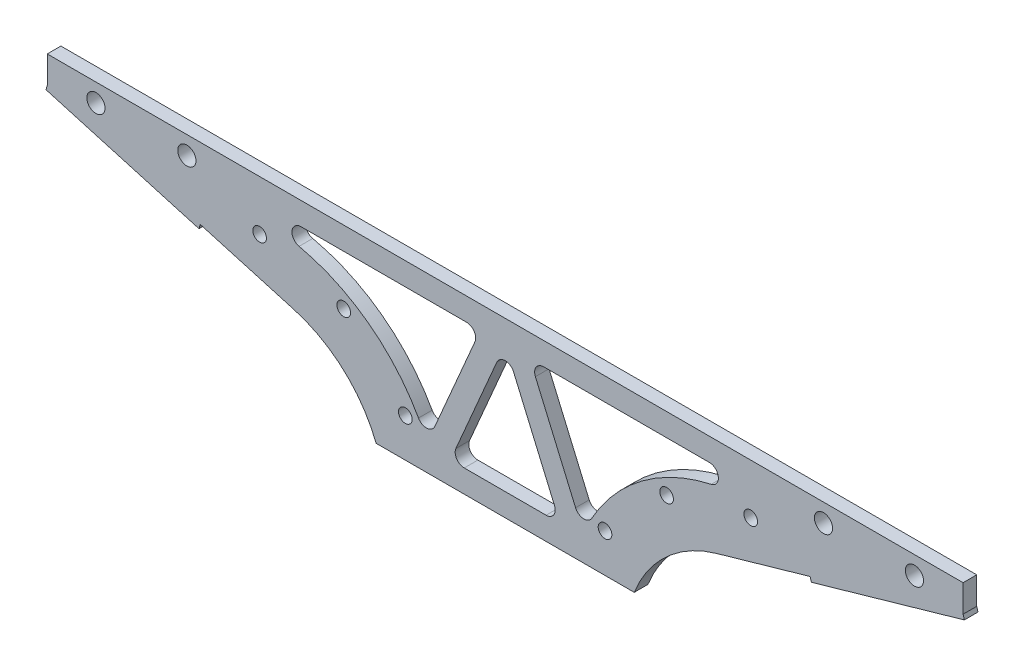
from build123d import *

# Parameters (mm, degrees)
SKETCH_1_R          = 1.5
SKETCH_1_R_2        = 2
EXTRUDE_1_DEPTH     = 3
EXTRUDE_2_DEPTH     = 3
CUT_EXTRUDE_1_DEPTH = 112.846375834


with BuildPart() as part:
    # 草图1 → 凸台-拉伸1 (new body)
    with BuildSketch(Plane.XY):
        with BuildLine():
            Line((-46.419972715, 26.434696638), (-100.702636481, 42))
            Line((-100.702636481, 42), (-100.702636481, 48))
            Line((-100.702636481, 48), (100.702636481, 48))
            Line((100.702636481, 48), (100.702636481, 42))
            Line((100.702636481, 42), (46.419972715, 26.434696638))
            ThreePointArc((46.419972715, 26.434696638), (35.478614393, 20.327525063), (28.382623085, 10))
            Line((28.382623085, 10), (-28.382623085, 10))
            ThreePointArc((-28.382623085, 10), (-35.478614393, 20.327525063), (-46.419972715, 26.434696638))
        make_face()
        with Locations((-54, 37)):
            Circle(SKETCH_1_R, mode=Mode.SUBTRACT)
        with Locations((-35.5, 32.04293994)):
            Circle(SKETCH_1_R, mode=Mode.SUBTRACT)
        with Locations((-21.95706006, 18.5)):
            Circle(SKETCH_1_R, mode=Mode.SUBTRACT)
        with Locations(Location((21.95706006, 18.5, 0), (0, 0, 180))):
            Circle(SKETCH_1_R, mode=Mode.SUBTRACT)
        with Locations(Location((35.5, 32.04293994, 0), (0, 0, 180))):
            Circle(SKETCH_1_R, mode=Mode.SUBTRACT)
        with Locations(Location((54, 37, 0), (0, 0, 180))):
            Circle(SKETCH_1_R, mode=Mode.SUBTRACT)
        with Locations((-90, 44)):
            Circle(SKETCH_1_R_2, mode=Mode.SUBTRACT)
        with Locations((-70, 44)):
            Circle(SKETCH_1_R_2, mode=Mode.SUBTRACT)
        with Locations(Location((70, 44, 0), (0, 0, 180))):
            Circle(SKETCH_1_R_2, mode=Mode.SUBTRACT)
        with Locations(Location((90, 44, 0), (0, 0, 180))):
            Circle(SKETCH_1_R_2, mode=Mode.SUBTRACT)
    extrude(amount=EXTRUDE_1_DEPTH)

    # 草图2 → 凸台-拉伸2 (add)
    with BuildSketch(Plane.XY.offset(3)):
        Polygon((-100.702636481, 42), (-100.978273837, 41.038738304), (-67.334114479, 31.39143085), (-67.058477124, 32.352692546), align=None)
        Polygon((67.058477124, 32.352692546), (100.702636481, 42), (100.978273837, 41.038738304), (67.334114479, 31.39143085), align=None)
    extrude(amount=-EXTRUDE_2_DEPTH)

    # 草图3 → 切除-拉伸1 (cut, through all)
    with BuildSketch(Plane.XY.offset(3)):
        with BuildLine():
            Line((-6.641746516, 40.210125207), (-15.476556882, 19.658485028))
            ThreePointArc((-15.476556882, 19.658485028), (-17.211519663, 18.450985714), (-19.06092662, 19.474628401))
            ThreePointArc((-19.06092662, 19.474628401), (-30.09691848, 32.072460053), (-45.323396591, 39.047619048))
            ThreePointArc((-45.323396591, 39.047619048), (-46.877626016, 41.21821789), (-44.889566421, 43))
            Line((-44.889566421, 43), (-8.479162585, 43))
            ThreePointArc((-8.479162585, 43), (-6.808870756, 42.100056911), (-6.641746516, 40.210125207))
        make_face()
        with BuildLine():
            Line((-10.837416069, 17.789874793), (-1.837416069, 38.725781047))
            ThreePointArc((-1.837416069, 38.725781047), (0, 39.935906254), (1.837416069, 38.725781047))
            Line((1.837416069, 38.725781047), (10.837416069, 17.789874793))
            ThreePointArc((10.837416069, 17.789874793), (10.670291829, 15.899943089), (9, 15))
            Line((9, 15), (-9, 15))
            ThreePointArc((-9, 15), (-10.670291829, 15.899943089), (-10.837416069, 17.789874793))
        make_face()
        with BuildLine():
            Line((44.889566421, 43), (8.479162585, 43))
            ThreePointArc((8.479162585, 43), (6.808870756, 42.100056911), (6.641746516, 40.210125207))
            Line((6.641746516, 40.210125207), (15.476556882, 19.658485028))
            ThreePointArc((15.476556882, 19.658485028), (17.211519663, 18.450985714), (19.06092662, 19.474628401))
            ThreePointArc((19.06092662, 19.474628401), (30.09691848, 32.072460053), (45.323396591, 39.047619048))
            ThreePointArc((45.323396591, 39.047619048), (46.877626016, 41.21821789), (44.889566421, 43))
        make_face()
    extrude(amount=-CUT_EXTRUDE_1_DEPTH, mode=Mode.SUBTRACT)


solid = part.part
